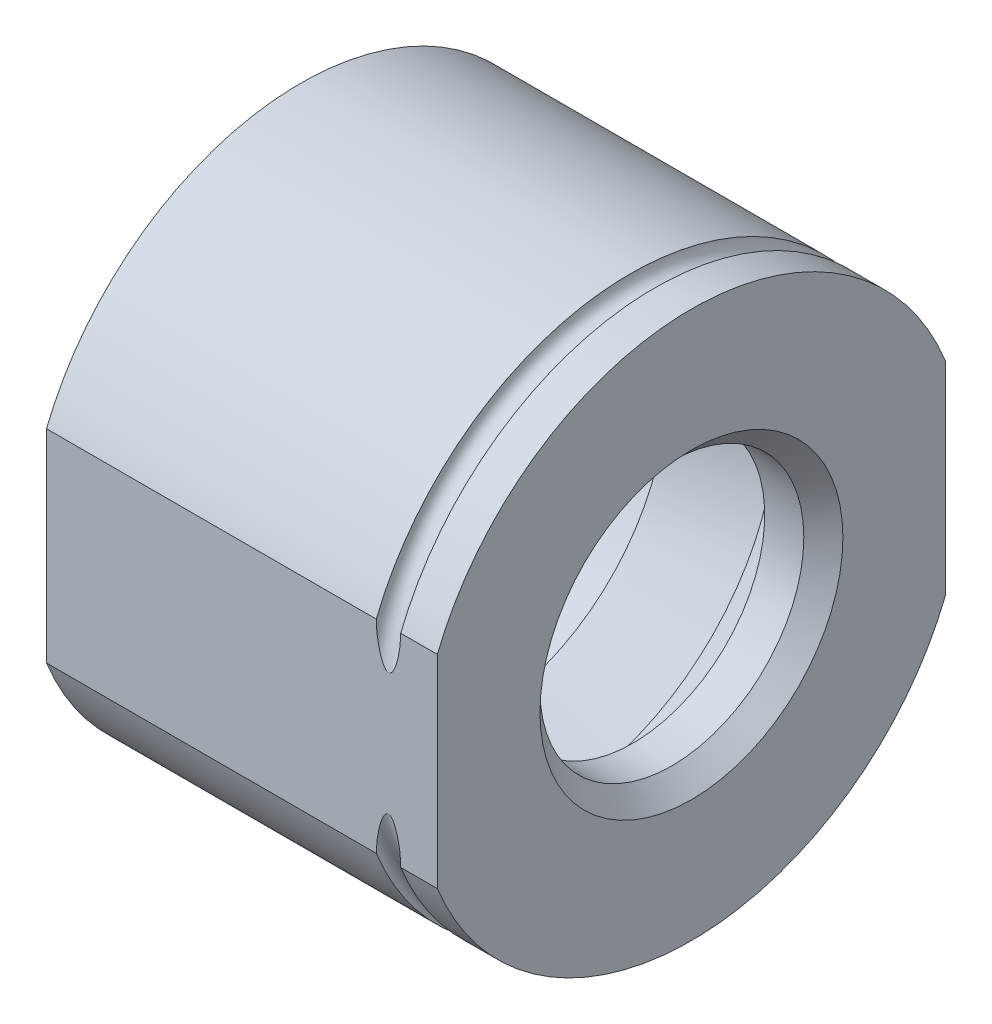
from build123d import *

# Parameters (mm, degrees)
BOSS_EXTRUDE1_DEPTH = 2.032
CHAMFER1_SIZE       = 0.1016


with BuildPart() as part:
    # Sketch1 → Boss-Extrude1 (new body)
    with BuildSketch(Plane(origin=(1.9304, 0, 0), x_dir=(0, 0, -1), z_dir=(1, 0, 0))):
        with BuildLine():
            Line((1.3208, -0.527317703), (1.3208, 0.527317703))
            ThreePointArc((1.3208, 0.527317703), (0, 1.422173196), (-1.3208, 0.527317703))
            Line((-1.3208, 0.527317703), (-1.3208, -0.527317703))
            ThreePointArc((-1.3208, -0.527317703), (0, -1.422173196), (1.3208, -0.527317703))
        make_face()
    extrude(amount=-BOSS_EXTRUDE1_DEPTH)

    # Sketch2 → Cut-Revolve1 (revolve, cut)
    with BuildSketch(Plane(origin=(0, 0, 0), x_dir=(-1, 0, 0), z_dir=(0, 0, -1)), mode=Mode.PRIVATE) as cut_revolve1_sk:
        Polygon((-1.9304, 0.6858), (-1.9304, 0), (0.1016, 0), (0.1016, 1.1049), (-0.8128, 1.1049), (-0.8128, 0.987363608), (-1.2192, 1.1557), (-1.6256, 0.987363608), (-1.6256, 0.6858), align=None)
    revolve(cut_revolve1_sk.sketch.rotate(Axis((1.9304, 0, 0), (-1, 0, 0)), 270), axis=Axis((1.9304, 0, 0), (-1, 0, 0)), mode=Mode.SUBTRACT)

    # Chamfer1
    chamfer1_edges = [part.edges().sort_by_distance(p)[0] for p in [
        (1.9304, 0, -0.6858),
    ]]
    chamfer(chamfer1_edges, length=CHAMFER1_SIZE)

    # Sketch3 → Cut-Revolve2 (revolve, cut)
    with BuildSketch(Plane.XY, mode=Mode.PRIVATE) as cut_revolve2_sk:
        with BuildLine():
            Line((1.7399, 1.422173196), (1.6129, 1.422173196))
            ThreePointArc((1.6129, 1.422173196), (1.6764, 1.358673196), (1.7399, 1.422173196))
        make_face()
    revolve(cut_revolve2_sk.sketch.rotate(Axis((-0.1016, 0, 0), (1, 0, 0)), 270), axis=Axis((-0.1016, 0, 0), (1, 0, 0)), mode=Mode.SUBTRACT)


solid = part.part
